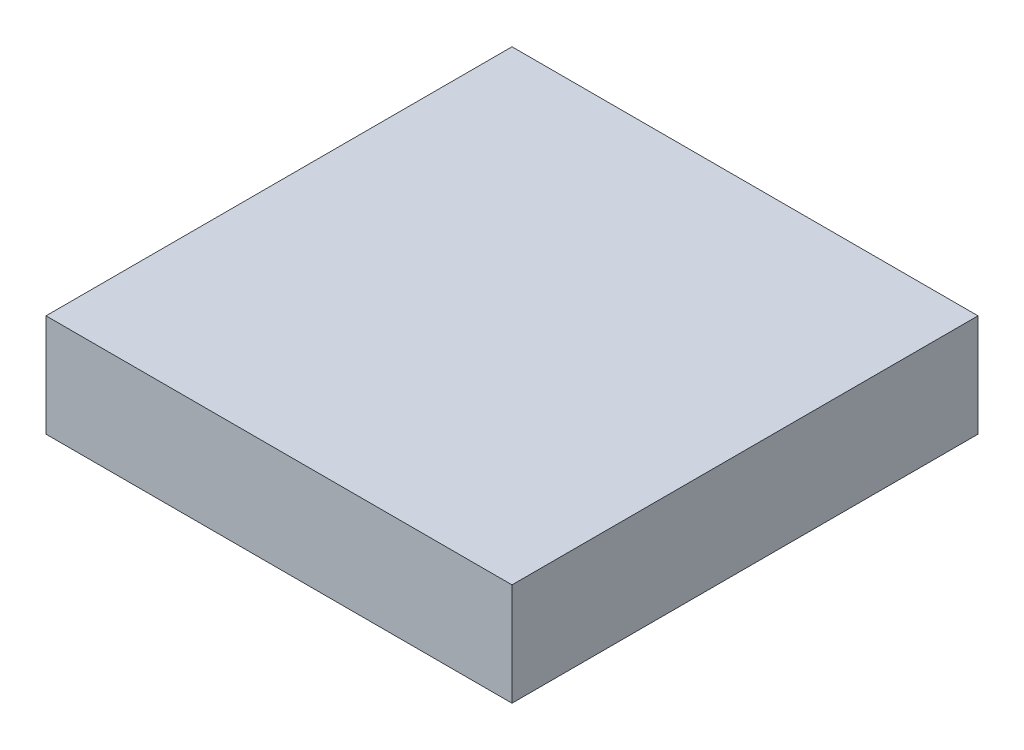
from build123d import *

# Parameters (mm, degrees)
SKETCH2_W           = 25.4
SKETCH2_H           = 25.4
BOSS_EXTRUDE1_DEPTH = 5.588


with BuildPart() as part:
    # Sketch2 → Boss-Extrude1 (new body)
    with BuildSketch(Plane(origin=(0, 0, 0), x_dir=(1, 0, 0), z_dir=(0, 1, 0))):
        Rectangle(SKETCH2_W, SKETCH2_H)
    extrude(amount=BOSS_EXTRUDE1_DEPTH)


solid = part.part
